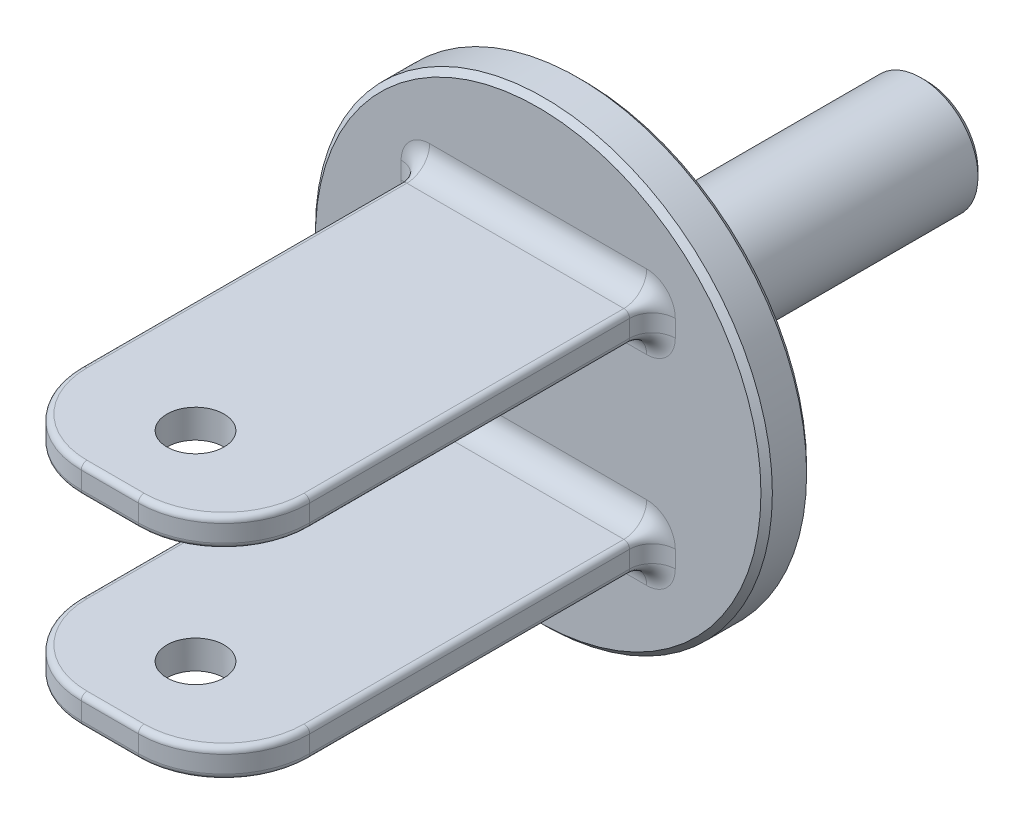
from build123d import *

# Parameters (mm, degrees)
SKETCH2_R                      = 40
BOSS_EXTRUDE1_DEPTH            = 8
SKETCH3_W                      = 40
SKETCH3_H                      = 5
BOSS_EXTRUDE2_DEPTH            = 75
FILLET1_R                      = 15
FILLET3_R                      = 1
FILLET5_R                      = 4
FILLET1_OF_MIRROR3_R           = 15
FILLET3_OF_MIRROR3_R           = 1
FILLET5_OF_MIRROR3_R           = 4
CUT_EXTRUDE5_REACH             = 102.444
SKETCH6_R                      = 5
CUT_EXTRUDE5_DIRECTION_2_REACH = 102.444
SKETCH12_R                     = 10
SKETCH12_R_2                   = 7.5
BOSS_EXTRUDE6_DEPTH            = 60
CHAMFER2_SIZE                  = 1


with BuildPart() as part:
    # Sketch2 → Boss-Extrude1 (new body)
    with BuildSketch(Plane.XY):
        Circle(SKETCH2_R)
    extrude(amount=BOSS_EXTRUDE1_DEPTH)

    # Sketch3 → Boss-Extrude2 (add)
    with BuildSketch(Plane.XY.offset(8)):
        with Locations((0, 17.5)):
            Rectangle(SKETCH3_W, SKETCH3_H)
    boss_extrude2 = extrude(amount=BOSS_EXTRUDE2_DEPTH)

    # Fillet1
    fillet1_edges = [part.edges().sort_by_distance(p)[0] for p in [
        (-20, 17.5, 83),
        (20, 17.5, 83),
    ]]
    fillet(fillet1_edges, radius=FILLET1_R)

    # Fillet3
    fillet3_edges = [part.edges().sort_by_distance(p)[0] for p in [
        (0, 15, 83),
        (0, 20, 83),
        (-20, 20, 38),
        (20, 20, 38),
        (-15.606601718, 20, 78.606601718),
        (15.606601718, 20, 78.606601718),
        (20, 15, 38),
        (-20, 15, 38),
        (-15.606601718, 15, 78.606601718),
        (15.606601718, 15, 78.606601718),
    ]]
    fillet(fillet3_edges, radius=FILLET3_R)

    # Fillet5
    fillet5_edges = [part.edges().sort_by_distance(p)[0] for p in [
        (0, 20, 8),
        (20, 17.5, 8),
        (-20, 17.5, 8),
        (0, 15, 8),
        (19.707106781, 19.707106781, 8),
        (-19.707106781, 19.707106781, 8),
        (19.707106781, 15.292893219, 8),
        (-19.707106781, 15.292893219, 8),
    ]]
    fillet(fillet5_edges, radius=FILLET5_R)

    # Mirror3: Boss-Extrude2 across plane
    add(boss_extrude2.mirror(Plane.ZX))

    # Fillet1 of Mirror3
    fillet1_of_mirror3_edges = [part.edges().sort_by_distance(p)[0] for p in [
        (-20, -17.5, 83),
        (20, -17.5, 83),
    ]]
    fillet(fillet1_of_mirror3_edges, radius=FILLET1_OF_MIRROR3_R)

    # Fillet3 of Mirror3
    fillet3_of_mirror3_edges = [part.edges().sort_by_distance(p)[0] for p in [
        (0, -15, 83),
        (0, -20, 83),
        (-20, -20, 38),
        (20, -20, 38),
        (-15.606601718, -20, 78.606601718),
        (15.606601718, -20, 78.606601718),
        (20, -15, 38),
        (-20, -15, 38),
        (-15.606601718, -15, 78.606601718),
        (15.606601718, -15, 78.606601718),
    ]]
    fillet(fillet3_of_mirror3_edges, radius=FILLET3_OF_MIRROR3_R)

    # Fillet5 of Mirror3
    fillet5_of_mirror3_edges = [part.edges().sort_by_distance(p)[0] for p in [
        (0, -20, 8),
        (20, -17.5, 8),
        (-20, -17.5, 8),
        (0, -15, 8),
        (19.707106781, -19.707106781, 8),
        (-19.707106781, -19.707106781, 8),
        (19.707106781, -15.292893219, 8),
        (-19.707106781, -15.292893219, 8),
    ]]
    fillet(fillet5_of_mirror3_edges, radius=FILLET5_OF_MIRROR3_R)

    # Cut-Extrude5: up to this face of the body (flat: up to its plane)
    cut_extrude5_end = Plane(part.part.faces().sort_by_distance((0, 20, 45.959084637))[0])
    # Sketch6 → Cut-Extrude5 (cut, up to the picked face)
    with BuildSketch(Plane(origin=(0, 0, 0), x_dir=(1, 0, 0), z_dir=(0, 1, 0)), mode=Mode.PRIVATE) as cut_extrude5_sk1:
        with Locations((0, -68)):
            Circle(SKETCH6_R)
    cut_extrude5_tool1 = split(extrude(cut_extrude5_sk1.sketch, amount=CUT_EXTRUDE5_REACH, mode=Mode.PRIVATE), bisect_by=cut_extrude5_end, keep=Keep.BOTH, mode=Mode.PRIVATE)
    add(cut_extrude5_tool1.solids().sort_by(Axis((0, 0, 68), (0, 1, 0)))[0], mode=Mode.SUBTRACT)

    # Sketch6 → Cut-Extrude5 direction 2 (cut, up to next)
    with BuildSketch(Plane(origin=(0, 0, 0), x_dir=(1, 0, 0), z_dir=(0, 1, 0)), mode=Mode.PRIVATE) as cut_extrude5_direction_2_sk1:
        with Locations((0, -68)):
            Circle(SKETCH6_R)
    cut_extrude5_direction_2_tool1 = extrude(cut_extrude5_direction_2_sk1.sketch, amount=-CUT_EXTRUDE5_DIRECTION_2_REACH, mode=Mode.PRIVATE) & part.part
    add(cut_extrude5_direction_2_tool1.solids().sort_by_distance((0, 0, 68))[0], mode=Mode.SUBTRACT)

    # Sketch12 → Boss-Extrude6 (add)
    with BuildSketch(Plane.XY):
        Circle(SKETCH12_R)
        Circle(SKETCH12_R_2, mode=Mode.SUBTRACT)
    extrude(amount=-BOSS_EXTRUDE6_DEPTH)

    # Chamfer2
    chamfer2_edges = [part.edges().sort_by_distance(p)[0] for p in [
        (-40, 0, 0),
        (-10, 0, -60),
        (-40, 0, 8),
    ]]
    chamfer(chamfer2_edges, length=CHAMFER2_SIZE)


solid = part.part
